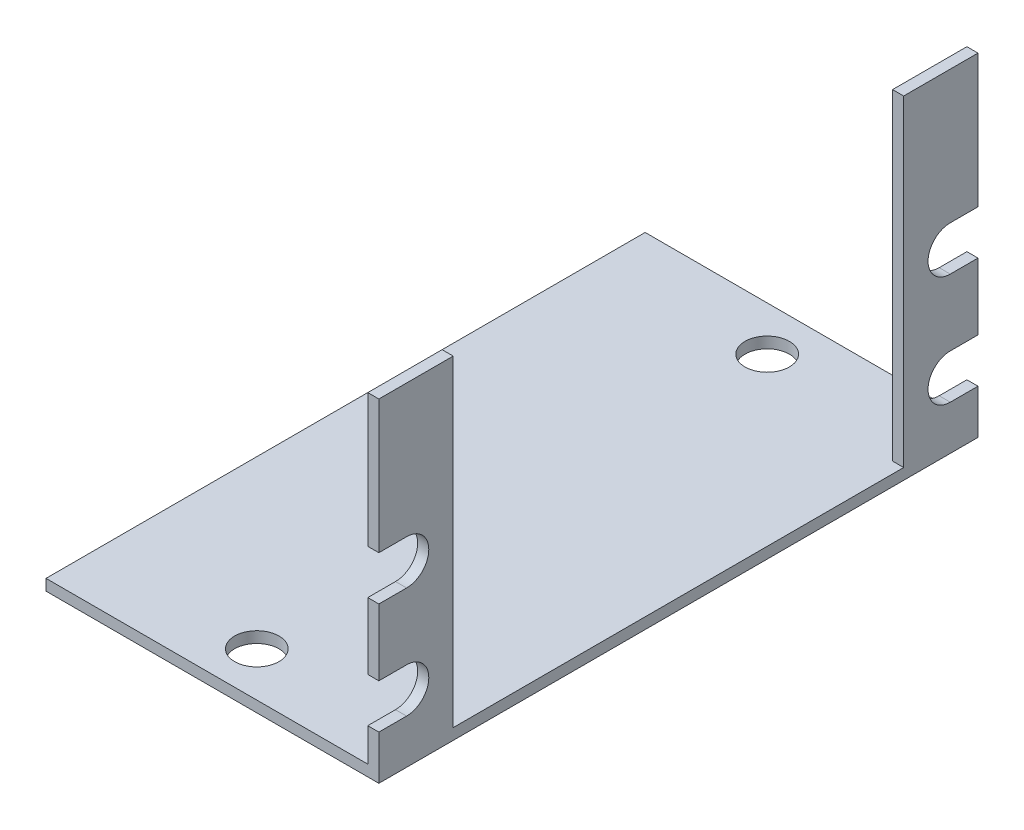
from build123d import *

# Parameters (mm, degrees)
BOSS_EXTRUDE1_DEPTH = 27
SKETCH2_W           = 40.6
SKETCH2_H           = 30
CUT_EXTRUDE1_DEPTH  = 50.101934789
CUT_EXTRUDE2_DEPTH  = 50.101934789


with BuildPart() as part:
    # Sketch1 → Boss-Extrude1 (new, symmetric)
    with BuildSketch(Plane.XY):
        Polygon((-29, 0), (0, 0), (0, 29), (1, 29), (1, -1), (-29, -1), align=None)
    extrude(amount=BOSS_EXTRUDE1_DEPTH, both=True)

    # Sketch2 → Cut-Extrude1 (cut, through all)
    with BuildSketch(Plane.ZY):
        with BuildLine():
            Line((-24.5, 17), (-27, 17))
            Line((-27, 17), (-27, 13))
            Line((-27, 13), (-24.5, 13))
            ThreePointArc((-24.5, 13), (-22.5, 15), (-24.5, 17))
        make_face()
        with Locations((0, 15)):
            Rectangle(SKETCH2_W, SKETCH2_H)
        with BuildLine():
            Line((-24.5, 3), (-27, 3))
            Line((-27, 3), (-27, 7))
            Line((-27, 7), (-24.5, 7))
            ThreePointArc((-24.5, 7), (-22.5, 5), (-24.5, 3))
        make_face()
        with BuildLine():
            Line((24.5, 7), (27, 7))
            Line((27, 7), (27, 3))
            Line((27, 3), (24.5, 3))
            ThreePointArc((24.5, 3), (22.5, 5), (24.5, 7))
        make_face()
        with BuildLine():
            Line((24.5, 13), (27, 13))
            Line((27, 13), (27, 17))
            Line((27, 17), (24.5, 17))
            ThreePointArc((24.5, 17), (22.5, 15), (24.5, 13))
        make_face()
    extrude(amount=-CUT_EXTRUDE1_DEPTH, mode=Mode.SUBTRACT)

    # Sketch3 → Cut-Extrude2 (cut, through all)
    with BuildSketch(Plane(origin=(0, 0, 0), x_dir=(1, 0, 0), z_dir=(0, 1, 0))):
        with BuildLine():
            ThreePointArc((-16, 23), (-14, 21), (-12, 23))
            ThreePointArc((-12, 23), (-14, 25), (-16, 23))
        make_face()
        with BuildLine():
            ThreePointArc((-12, -23), (-14, -21), (-16, -23))
            ThreePointArc((-16, -23), (-14, -25), (-12, -23))
        make_face()
    extrude(amount=-CUT_EXTRUDE2_DEPTH, mode=Mode.SUBTRACT)


solid = part.part
